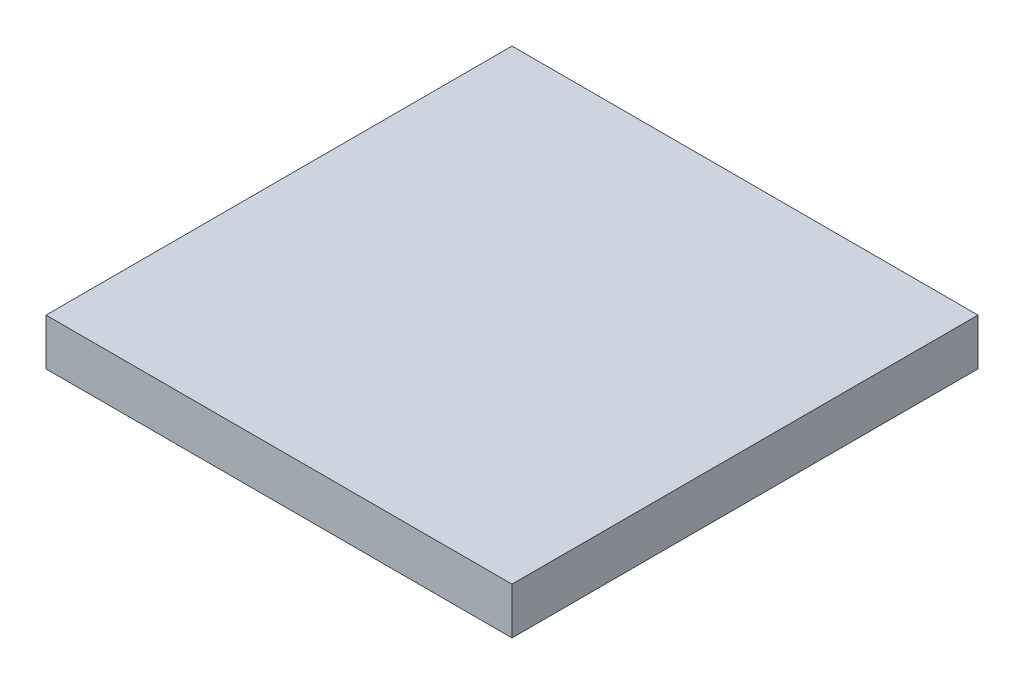
from build123d import *

# Parameters (mm, degrees)
SKETCH1_W           = 127
SKETCH1_H           = 127
BOSS_EXTRUDE1_DEPTH = 12.7


with BuildPart() as part:
    # Sketch1 → Boss-Extrude1 (new body)
    with BuildSketch(Plane(origin=(0, 0, 0), x_dir=(1, 0, 0), z_dir=(0, 1, 0))):
        Rectangle(SKETCH1_W, SKETCH1_H)
    extrude(amount=BOSS_EXTRUDE1_DEPTH)


solid = part.part
